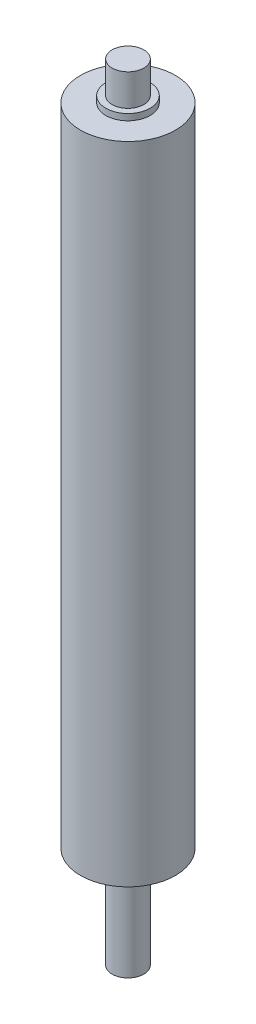
from build123d import *

# Parameters (mm, degrees)
SKETCH1_R           = 7.5
BOSS_EXTRUDE1_DEPTH = 102
SKETCH2_R           = 3.5
BOSS_EXTRUDE2_DEPTH = 1
SKETCH3_R           = 2.5
BOSS_EXTRUDE3_DEPTH = 15
BOSS_EXTRUDE4_START = 1
SKETCH4_R           = 3.5
BOSS_EXTRUDE4_DEPTH = 1
BOSS_EXTRUDE5_START = 5
SKETCH5_R           = 2.5
BOSS_EXTRUDE5_DEPTH = 5


with BuildPart() as part:
    # Sketch1 → Boss-Extrude1 (new body)
    with BuildSketch(Plane(origin=(0, 0, 0), x_dir=(1, 0, 0), z_dir=(0, 1, 0))):
        with Locations(Location((0, 0, 0), (0, 0, 270))):
            Circle(SKETCH1_R)
    extrude(amount=BOSS_EXTRUDE1_DEPTH)

    # Sketch2 → Boss-Extrude2 (add)
    with BuildSketch(Plane.XZ):
        with Locations(Location((0, 0, 0), (0, 0, 270))):
            Circle(SKETCH2_R)
    extrude(amount=BOSS_EXTRUDE2_DEPTH)

    # Sketch3 → Boss-Extrude3 (add)
    with BuildSketch(Plane.XZ.offset(1)):
        with Locations(Location((0, 0, 0), (0, 0, 270))):
            Circle(SKETCH3_R)
    extrude(amount=BOSS_EXTRUDE3_DEPTH)

    # Sketch4 → Boss-Extrude4 (add)
    with BuildSketch(Plane(origin=(0, 102, 0), x_dir=(1, 0, 0), z_dir=(0, 1, 0)).offset(BOSS_EXTRUDE4_START)):
        with Locations(Location((0, 0, 0), (0, 0, 90))):
            Circle(SKETCH4_R)
    extrude(amount=-BOSS_EXTRUDE4_DEPTH)

    # Sketch5 → Boss-Extrude5 (add)
    with BuildSketch(Plane(origin=(0, 103, 0), x_dir=(1, 0, 0), z_dir=(0, 1, 0)).offset(BOSS_EXTRUDE5_START)):
        with Locations(Location((0, 0, 0), (0, 0, 90))):
            Circle(SKETCH5_R)
    extrude(amount=-BOSS_EXTRUDE5_DEPTH)


solid = part.part
